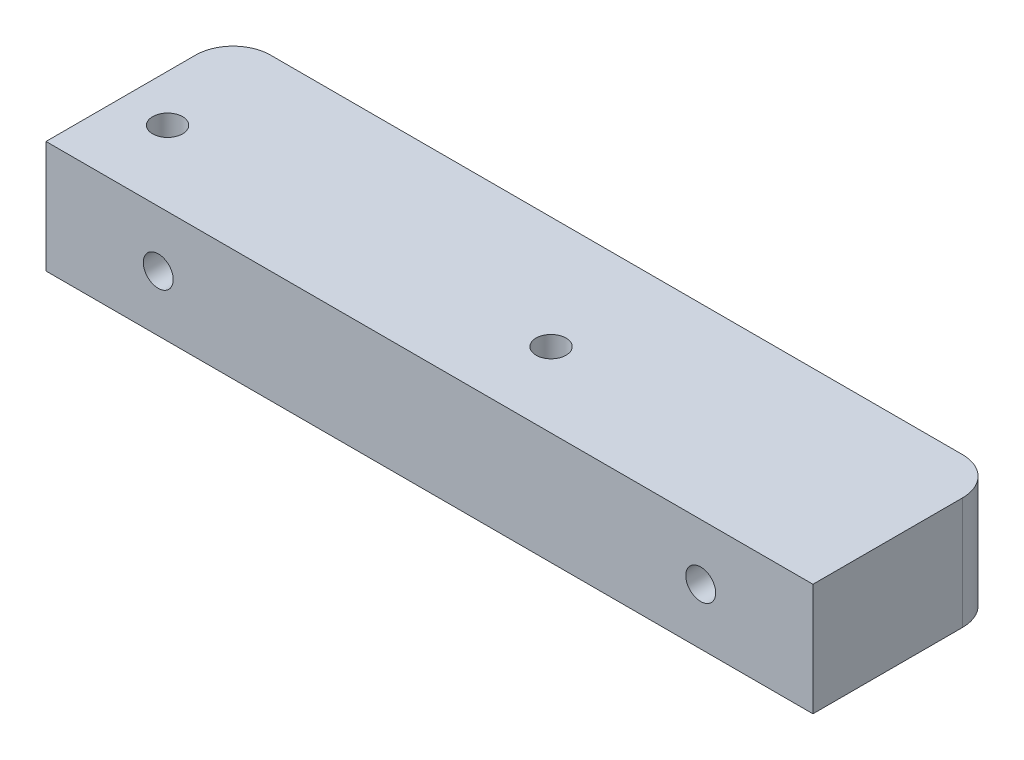
from build123d import *

# Parameters (mm, degrees)
SKETCH_1_W          = 41
SKETCH_1_H          = 10
EXTRUDE_1_DEPTH     = 6
SKETCH_2_R          = 0.8
CUT_EXTRUDE_1_DEPTH = 6
FILLET_1_R          = 2
SKETCH_6_R          = 0.8
CUT_EXTRUDE_3_DEPTH = 10


with BuildPart() as part:
    # 草图1 → 凸台-拉伸1 (new body)
    with BuildSketch(Plane(origin=(0, 0, 0), x_dir=(1, 0, 0), z_dir=(0, 1, 0))):
        with Locations((-20.5, 5)):
            Rectangle(SKETCH_1_W, SKETCH_1_H)
    extrude(amount=EXTRUDE_1_DEPTH)

    # 草图2 → 切除-拉伸1 (cut)
    with BuildSketch(Plane.XY):
        with Locations((-6, 3)):
            Circle(SKETCH_2_R)
        with Locations((-35, 3)):
            Circle(SKETCH_2_R)
    extrude(amount=-CUT_EXTRUDE_1_DEPTH, mode=Mode.SUBTRACT)

    # 圆角1
    fillet_1_edges = [part.edges().sort_by_distance(p)[0] for p in [
        (-41, 3, -10),
        (0, 3, -10),
    ]]
    fillet(fillet_1_edges, radius=FILLET_1_R)

    # 草图6 → 切除-拉伸3 (cut)
    with BuildSketch(Plane(origin=(0, 0, 0), x_dir=(-1, 0, 0), z_dir=(0, -1, 0))):
        with Locations(Location((38.5, 4, 0), (0, 0, 90))):
            Circle(SKETCH_6_R)
        with Locations(Location((18, 4, 0), (0, 0, 90))):
            Circle(SKETCH_6_R)
    extrude(amount=-CUT_EXTRUDE_3_DEPTH, mode=Mode.SUBTRACT)


solid = part.part
